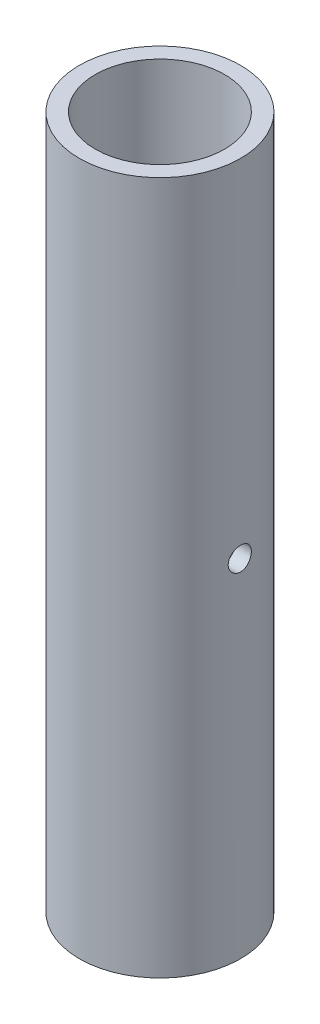
from build123d import *

# Parameters (mm, degrees)
SKETCH2_R                   = 17.45
SKETCH2_R_2                 = 14
BOSS_EXTRUDE1_DEPTH         = 150
TAP_DRILL_FOR_M6X1_0_TAP1_D = 5


with BuildPart() as part:
    # Sketch2 → Boss-Extrude1 (new body)
    with BuildSketch(Plane(origin=(0, 0, 0), x_dir=(1, 0, 0), z_dir=(0, 1, 0))):
        with Locations(Location((0, 0, 0), (0, 0, 270))):
            Circle(SKETCH2_R)
        with Locations(Location((0, 0, 0), (0, 0, 270))):
            Circle(SKETCH2_R_2, mode=Mode.SUBTRACT)
    extrude(amount=-BOSS_EXTRUDE1_DEPTH)

    # Tap Drill for M6x1.0 Tap1 (through all)
    with Locations(Plane(origin=(17.45, 0, 0), x_dir=(0, 0, -1), z_dir=(1, 0, 0))):
        with Locations((0, -75)):
            Hole(TAP_DRILL_FOR_M6X1_0_TAP1_D / 2)


solid = part.part
